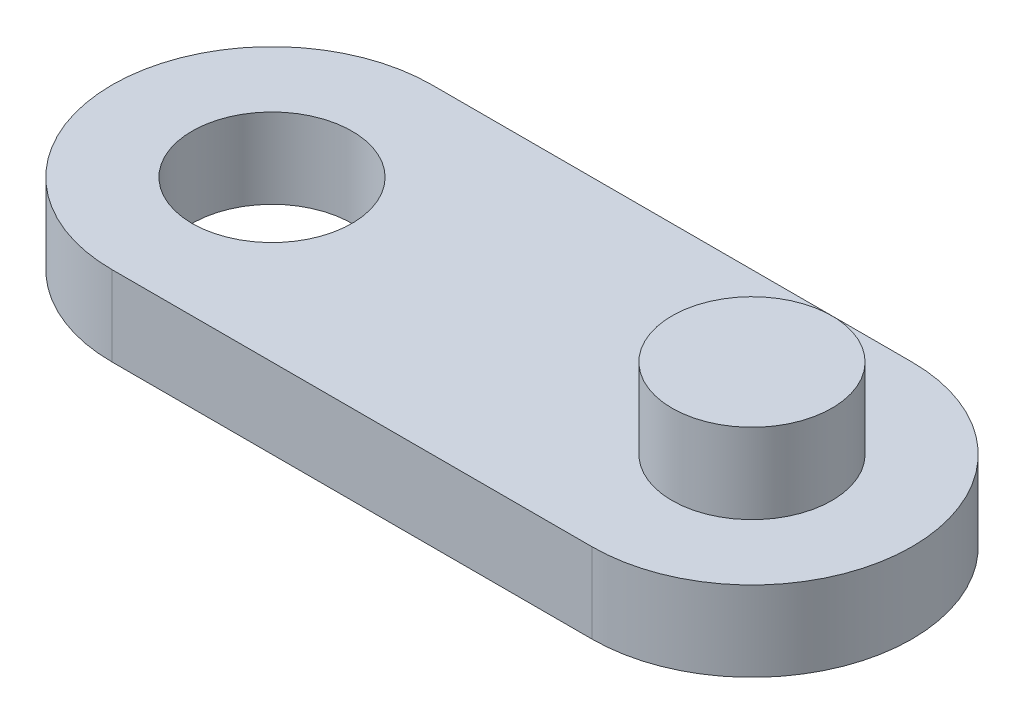
from build123d import *

# Parameters (mm, degrees)
BOSS_EXTRUDE1_DEPTH = 5
SKETCH2_R           = 5
BOSS_EXTRUDE2_DEPTH = 5
SKETCH3_R           = 5
CUT_EXTRUDE1_DEPTH  = 28.386127875


with BuildPart() as part:
    # Sketch1 → Boss-Extrude1 (new body)
    with BuildSketch(Plane(origin=(0, 0, 0), x_dir=(1, 0, 0), z_dir=(0, 1, 0))):
        with BuildLine():
            Line((-15, 10), (15, 10))
            ThreePointArc((15, 10), (25, 0), (15, -10))
            Line((15, -10), (-15, -10))
            ThreePointArc((-15, -10), (-25, 0), (-15, 10))
        make_face()
    extrude(amount=BOSS_EXTRUDE1_DEPTH)

    # Sketch2 → Boss-Extrude2 (add)
    with BuildSketch(Plane(origin=(0, 5, 0), x_dir=(1, 0, 0), z_dir=(0, 1, 0))):
        with Locations(Location((15, 0, 0), (0, 0, 270))):
            Circle(SKETCH2_R)
    extrude(amount=BOSS_EXTRUDE2_DEPTH)

    # Sketch3 → Cut-Extrude1 (cut, through all)
    with BuildSketch(Plane(origin=(0, 5, 0), x_dir=(1, 0, 0), z_dir=(0, 1, 0))):
        with Locations(Location((-15, 0, 0), (0, 0, 270))):
            Circle(SKETCH3_R)
    extrude(amount=-CUT_EXTRUDE1_DEPTH, mode=Mode.SUBTRACT)


solid = part.part
